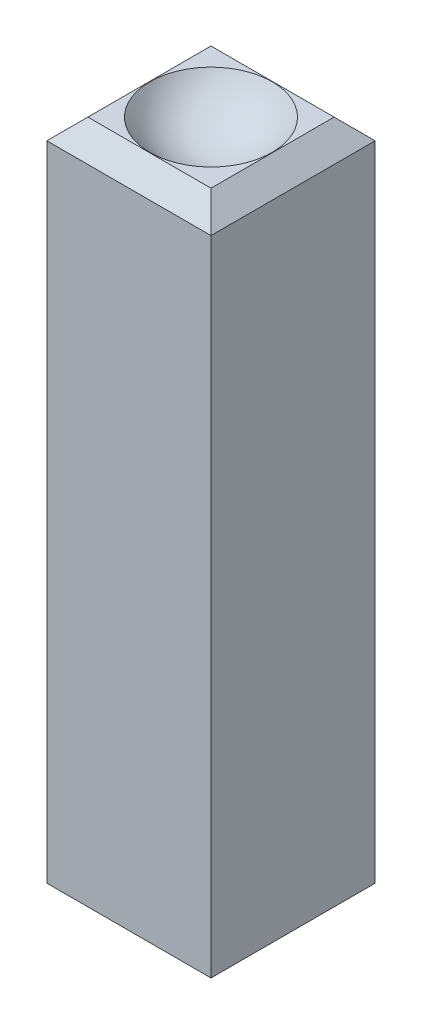
from build123d import *

# Parameters (mm, degrees)
SKETCH1_W           = 24
SKETCH1_H           = 24
SKETCH1_W_2         = 20.5
SKETCH1_H_2         = 20.5
BOSS_EXTRUDE1_DEPTH = 48.5
CUT_EXTRUDE1_START  = -48.5
SKETCH1_4_W         = 20.5
SKETCH1_4_H         = 20.5
CUT_EXTRUDE1_DEPTH  = 40
CHAMFER2_SIZE       = 3


with BuildPart() as part:
    # Sketch1 → Boss-Extrude1 (new, symmetric)
    # profile 1 of 2: a face of its own
    with BuildSketch(Plane(origin=(0, 0, 0), x_dir=(1, 0, 0), z_dir=(0, 1, 0))):
        Rectangle(SKETCH1_W, SKETCH1_H)
        Rectangle(SKETCH1_W_2, SKETCH1_H_2, mode=Mode.SUBTRACT)
    # profile 2 of 2: a face of its own
    with BuildSketch(Plane(origin=(0, 0, 0), x_dir=(1, 0, 0), z_dir=(0, 1, 0))):
        Rectangle(SKETCH1_W_2, SKETCH1_H_2)
    extrude(amount=BOSS_EXTRUDE1_DEPTH, both=True)

    # Sketch1<4> → Cut-Extrude1 (cut)
    with BuildSketch(Plane(origin=(0, 0, 0), x_dir=(1, 0, 0), z_dir=(0, 1, 0)).offset(CUT_EXTRUDE1_START)):
        Rectangle(SKETCH1_4_W, SKETCH1_4_H)
    extrude(amount=CUT_EXTRUDE1_DEPTH, mode=Mode.SUBTRACT)

    # Sketch3 → Cut-Revolve1 (revolve, cut)
    with BuildSketch(Plane.XY):
        with BuildLine():
            Line((-8.947765084, 48.5), (0, 48.5))
            Line((0, 48.5), (0, 43.25))
            ThreePointArc((0, 43.25), (-5.18712348, 44.659397645), (-8.947765084, 48.5))
        make_face()
    revolve(axis=Axis((0, 64.835592649, 0), (0, -1, 0)), mode=Mode.SUBTRACT)

    # Chamfer2
    chamfer2_edges = [part.edges().sort_by_distance(p)[0] for p in [
        (12, 48.5, 0),
        (0, 48.5, -12),
        (-12, 48.5, 0),
        (0, 48.5, 12),
    ]]
    chamfer(chamfer2_edges, length=CHAMFER2_SIZE)


solid = part.part
